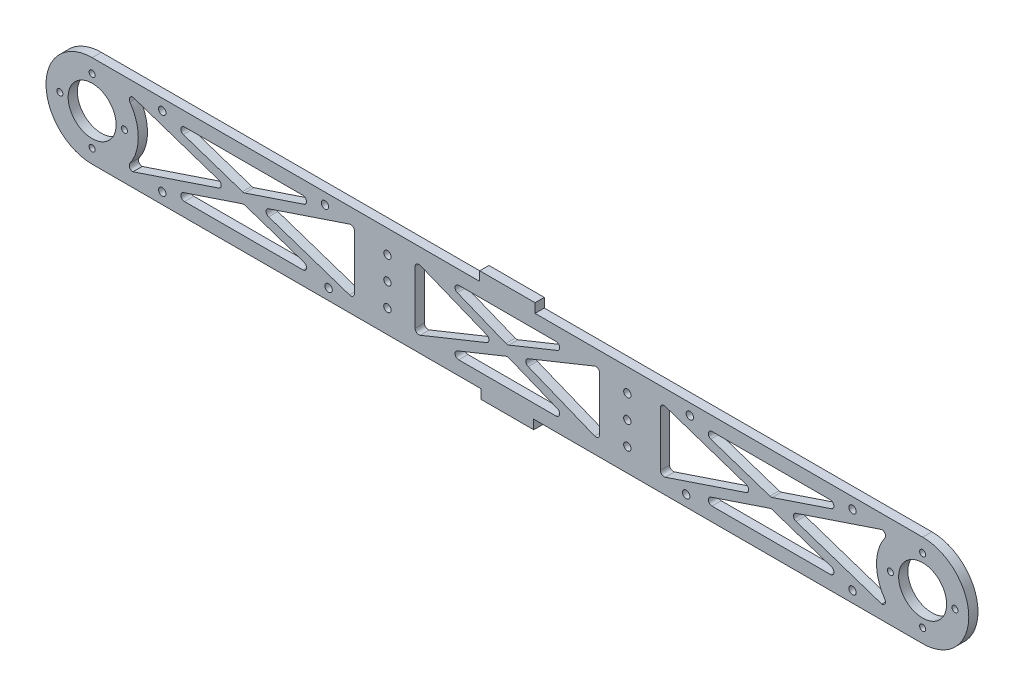
from build123d import *

# Parameters (mm, degrees)
SKETCH_1_R          = 13
SKETCH_1_R_2        = 1.65
EXTRUDE_1_DEPTH     = 5
SKETCH_2_R          = 2
CUT_EXTRUDE_2_DEPTH = 5
CUT_EXTRUDE_START   = -5
CUT_EXTRUDE_3_DEPTH = 5
FILLET_1_R          = 2
FILLET_2_R          = 2
FILLET_3_R          = 2
CUT_EXTRUDE_5_DEPTH = 5
SKETCH_9_R          = 2
CUT_EXTRUDE_6_DEPTH = 10
SKETCH_10_R         = 2
CUT_EXTRUDE_7_DEPTH = 10
SKETCH_11_W         = 30
SKETCH_11_H         = 5
EXTRUDE_2_DEPTH     = 5
SKETCH_12_W         = 28.554441288
SKETCH_12_H         = 5
EXTRUDE_3_DEPTH     = 5


with BuildPart() as part:
    # 草图1 → 凸台-拉伸1 (new body)
    with BuildSketch(Plane.XY):
        with BuildLine():
            Line((0, 25), (450, 25))
            ThreePointArc((450, 25), (475, 0), (450, -25))
            Line((450, -25), (0, -25))
            ThreePointArc((0, -25), (-25, 0), (0, 25))
        make_face()
        Circle(SKETCH_1_R, mode=Mode.SUBTRACT)
        with Locations((17.5, 0)):
            Circle(SKETCH_1_R_2, mode=Mode.SUBTRACT)
        with Locations((0, -17.5)):
            Circle(SKETCH_1_R_2, mode=Mode.SUBTRACT)
        with Locations((-17.5, 0)):
            Circle(SKETCH_1_R_2, mode=Mode.SUBTRACT)
        with Locations((0, 17.5)):
            Circle(SKETCH_1_R_2, mode=Mode.SUBTRACT)
        with Locations((450, 0)):
            Circle(SKETCH_1_R, mode=Mode.SUBTRACT)
        with Locations((432.5, 0)):
            Circle(SKETCH_1_R_2, mode=Mode.SUBTRACT)
        with Locations((450, 17.5)):
            Circle(SKETCH_1_R_2, mode=Mode.SUBTRACT)
        with Locations((450, -17.5)):
            Circle(SKETCH_1_R_2, mode=Mode.SUBTRACT)
        with Locations((467.5, 0)):
            Circle(SKETCH_1_R_2, mode=Mode.SUBTRACT)
    extrude(amount=EXTRUDE_1_DEPTH)

    # 草图2 → 切除-拉伸2 (cut)
    with BuildSketch(Plane.XY.offset(5)):
        with Locations((290, 12.5)):
            Circle(SKETCH_2_R)
        with Locations((290, 0)):
            Circle(SKETCH_2_R)
        with Locations((290, -12.5)):
            Circle(SKETCH_2_R)
        with Locations((160, 12.5)):
            Circle(SKETCH_2_R)
        with Locations((160, 0)):
            Circle(SKETCH_2_R)
        with Locations((160, -12.5)):
            Circle(SKETCH_2_R)
    extrude(amount=-CUT_EXTRUDE_2_DEPTH, mode=Mode.SUBTRACT)

    # 草图4 → 切除-拉伸3 (cut)
    with BuildSketch(Plane.XY.offset(5).offset(CUT_EXTRUDE_START)):
        with BuildLine():
            Line((74.250402222, 0), (22.107690969, -17.5))
            ThreePointArc((22.107690969, -17.5), (20.333388811, -16.422958207), (20.470084231, -14.351851852))
            ThreePointArc((20.470084231, -14.351851852), (25, 0), (20.470084231, 14.351851852))
            ThreePointArc((20.470084231, 14.351851852), (20.333388811, 16.422958207), (22.107690969, 17.5))
            Line((22.107690969, 17.5), (74.250402222, 0))
        make_face()
        Polygon((82.107690969, -2.637042643), (126.393113474, -17.5), (37.822268465, -17.5), align=None)
        Polygon((37.822268465, 17.5), (126.393113474, 17.5), (82.107690969, 2.637042643), align=None)
        Polygon((142.107690969, 17.5), (142.107690969, -17.5), (89.964979717, 0), align=None)
    cut_extrude_3 = extrude(amount=CUT_EXTRUDE_3_DEPTH, mode=Mode.SUBTRACT)

    # 圆角1
    fillet_1_edges = [part.edges().sort_by_distance(p)[0] for p in [
        (142.107690969, 17.5, 2.5),
    ]]
    fillet(fillet_1_edges, radius=FILLET_1_R)

    # 圆角2
    fillet_2_edges = [part.edges().sort_by_distance(p)[0] for p in [
        (37.822268465, -17.5, 2.5),
        (82.107690969, -2.637042643, 2.5),
        (126.393113474, -17.5, 2.5),
        (89.964979717, 0, 2.5),
        (142.107690969, -17.5, 2.5),
        (126.393113474, 17.5, 2.5),
        (82.107690969, 2.637042643, 2.5),
        (37.822268465, 17.5, 2.5),
        (74.250402222, 0, 2.5),
    ]]
    fillet(fillet_2_edges, radius=FILLET_2_R)

    # 镜向1: 切除-拉伸3 across plane
    add(cut_extrude_3.mirror(Plane(origin=(225, 0, 0), x_dir=(0, 0, 1), z_dir=(1, 0, 0))), mode=Mode.SUBTRACT)

    # 圆角3
    fillet_3_edges = [part.edges().sort_by_distance(p)[0] for p in [
        (375.749597778, 0, 2.5),
        (367.892309031, -2.637042643, 2.5),
        (412.177731535, -17.5, 2.5),
        (323.606886526, -17.5, 2.5),
        (307.892309031, 17.5, 2.5),
        (360.035020283, 0, 2.5),
        (307.892309031, -17.5, 2.5),
        (367.892309031, 2.637042643, 2.5),
        (323.606886526, 17.5, 2.5),
        (412.177731535, 17.5, 2.5),
    ]]
    fillet(fillet_3_edges, radius=FILLET_3_R)

    # 草图8 → 切除-拉伸5 (cut)
    with BuildSketch(Plane.XY.offset(5)):
        with BuildLine():
            Line((198.641718603, 17.5), (251.358281397, 17.5))
            ThreePointArc((251.358281397, 17.5), (253.321552393, 15.881532429), (252.107332949, 13.645566994))
            Line((252.107332949, 13.645566994), (225.749051552, 2.998802443))
            ThreePointArc((225.749051552, 2.998802443), (225, 2.853235449), (224.250948448, 2.998802443))
            Line((224.250948448, 2.998802443), (197.892667051, 13.645566994))
            ThreePointArc((197.892667051, 13.645566994), (196.678447607, 15.881532429), (198.641718603, 17.5))
        make_face()
        with BuildLine():
            Line((175, 14.535156791), (175, -14.535156791))
            ThreePointArc((175, -14.535156791), (175.881541933, -16.193183193), (177.749051552, -16.389589796))
            Line((177.749051552, -16.389589796), (213.733857169, -1.854433006))
            ThreePointArc((213.733857169, -1.854433006), (214.984805617, 0), (213.733857169, 1.854433006))
            Line((213.733857169, 1.854433006), (177.749051552, 16.389589796))
            ThreePointArc((177.749051552, 16.389589796), (175.881541933, 16.193183193), (175, 14.535156791))
        make_face()
        with BuildLine():
            Line((198.641718603, -17.5), (251.358281397, -17.5))
            ThreePointArc((251.358281397, -17.5), (253.321552393, -15.881532429), (252.107332949, -13.645566994))
            Line((252.107332949, -13.645566994), (225.749051552, -2.998802443))
            ThreePointArc((225.749051552, -2.998802443), (225, -2.853235449), (224.250948448, -2.998802443))
            Line((224.250948448, -2.998802443), (197.892667051, -13.645566994))
            ThreePointArc((197.892667051, -13.645566994), (196.678447607, -15.881532429), (198.641718603, -17.5))
        make_face()
        with BuildLine():
            Line((275, 14.535156791), (275, -14.535156791))
            ThreePointArc((275, -14.535156791), (274.118458067, -16.193183193), (272.250948448, -16.389589796))
            Line((272.250948448, -16.389589796), (236.266142831, -1.854433006))
            ThreePointArc((236.266142831, -1.854433006), (235.015194383, 0), (236.266142831, 1.854433006))
            Line((236.266142831, 1.854433006), (272.250948448, 16.389589796))
            ThreePointArc((272.250948448, 16.389589796), (274.118458067, 16.193183193), (275, 14.535156791))
        make_face()
    extrude(amount=-CUT_EXTRUDE_5_DEPTH, mode=Mode.SUBTRACT)

    # 草图9 → 切除-拉伸6 (cut)
    with BuildSketch(Plane.XY.offset(5)):
        with Locations((38, 19)):
            Circle(SKETCH_9_R)
        with Locations((38, -19)):
            Circle(SKETCH_9_R)
    cut_extrude_6 = extrude(amount=-CUT_EXTRUDE_6_DEPTH, mode=Mode.SUBTRACT)

    # 镜向2: 切除-拉伸6 across plane
    add(cut_extrude_6.mirror(Plane(origin=(225, 0, 0), x_dir=(0, 0, 1), z_dir=(1, 0, 0))), mode=Mode.SUBTRACT)

    # 草图10 → 切除-拉伸7 (cut)
    with BuildSketch(Plane.XY.offset(5)):
        with Locations((126.148115476, 19)):
            Circle(SKETCH_10_R)
        with Locations((128.121960299, -19)):
            Circle(SKETCH_10_R)
    cut_extrude_7 = extrude(amount=-CUT_EXTRUDE_7_DEPTH, mode=Mode.SUBTRACT)

    # 镜向3: 切除-拉伸7 across plane
    add(cut_extrude_7.mirror(Plane(origin=(225, 0, 0), x_dir=(0, 0, 1), z_dir=(1, 0, 0))), mode=Mode.SUBTRACT)

    # 草图11 → 凸台-拉伸2 (add)
    with BuildSketch(Plane(origin=(0, 25, 0), x_dir=(1, 0, 0), z_dir=(0, 1, 0))):
        with Locations((225, -2.5)):
            Rectangle(SKETCH_11_W, SKETCH_11_H)
    extrude(amount=EXTRUDE_2_DEPTH)

    # 草图12 → 凸台-拉伸3 (add)
    with BuildSketch(Plane.XZ.offset(25)):
        with Locations((225, 2.5)):
            Rectangle(SKETCH_12_W, SKETCH_12_H)
    extrude(amount=EXTRUDE_3_DEPTH)


solid = part.part
